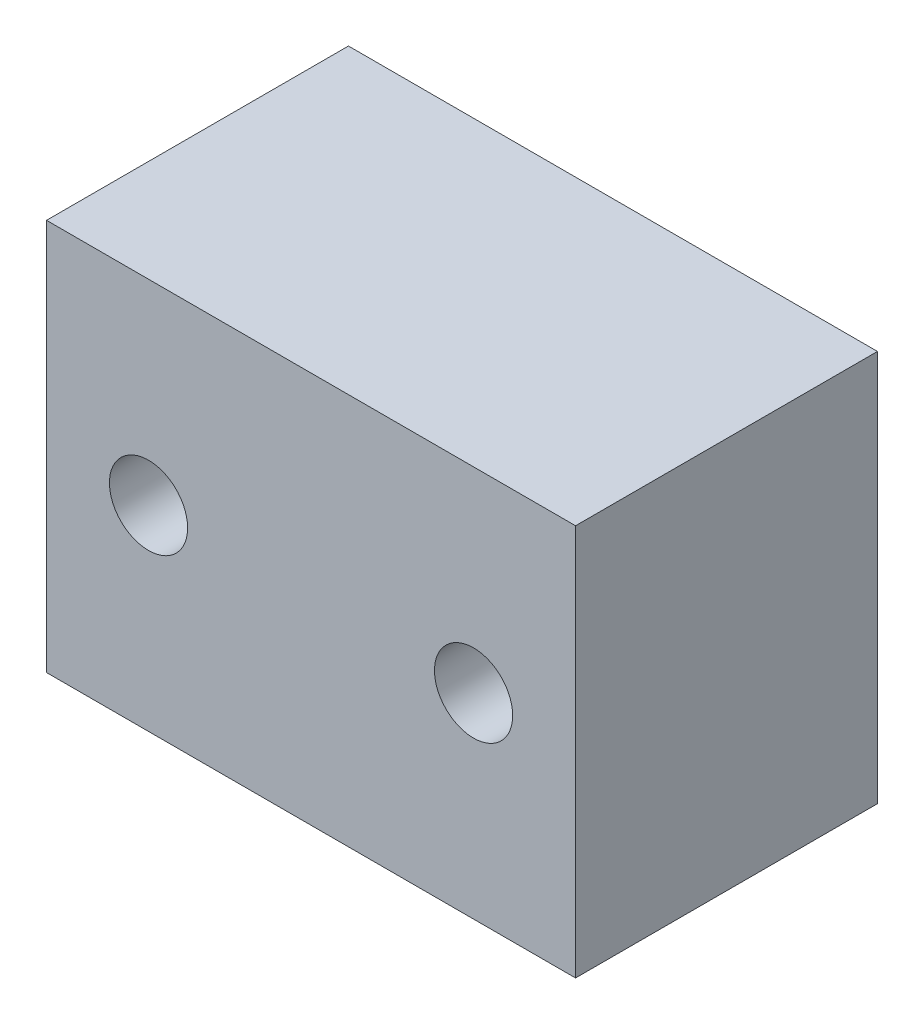
from build123d import *

# Parameters (mm, degrees)
SKIZZE1_W                                           = 155.6
SKIZZE1_H                                           = 115.2
AUFSATZ_LINEAR_AUSTRAGEN1_DEPTH                     = 88.8
STIRNSENKUNG_F_R_M8_SENKSCHRAUBE_KOPF_B_D           = 9
STIRNSENKUNG_F_R_M8_SENKSCHRAUBE_KOPF_B_CBORE_D     = 23
STIRNSENKUNG_F_R_M8_SENKSCHRAUBE_KOPF_B_CBORE_DEPTH = 80


with BuildPart() as part:
    # Skizze1 → Aufsatz-Linear austragen1 (new body)
    with BuildSketch(Plane.XY):
        Rectangle(SKIZZE1_W, SKIZZE1_H)
    extrude(amount=AUFSATZ_LINEAR_AUSTRAGEN1_DEPTH)

    # Stirnsenkung für M8 Senkschraube (Kopf Button)1 (through all)
    with Locations(Plane.XY.offset(88.8)):
        with Locations((-47.8, 0)):
            stirnsenkung_f_r_m8_senkschraube_kopf_b = CounterBoreHole(STIRNSENKUNG_F_R_M8_SENKSCHRAUBE_KOPF_B_D / 2, STIRNSENKUNG_F_R_M8_SENKSCHRAUBE_KOPF_B_CBORE_D / 2, STIRNSENKUNG_F_R_M8_SENKSCHRAUBE_KOPF_B_CBORE_DEPTH)

    # Spiegeln1: Stirnsenkung für M8 Senkschraube (Kopf Button)1 across plane
    add(stirnsenkung_f_r_m8_senkschraube_kopf_b.mirror(Plane(origin=(0, 0, 0), x_dir=(0, 0, 1), z_dir=(1, 0, 0))), mode=Mode.SUBTRACT)


solid = part.part
